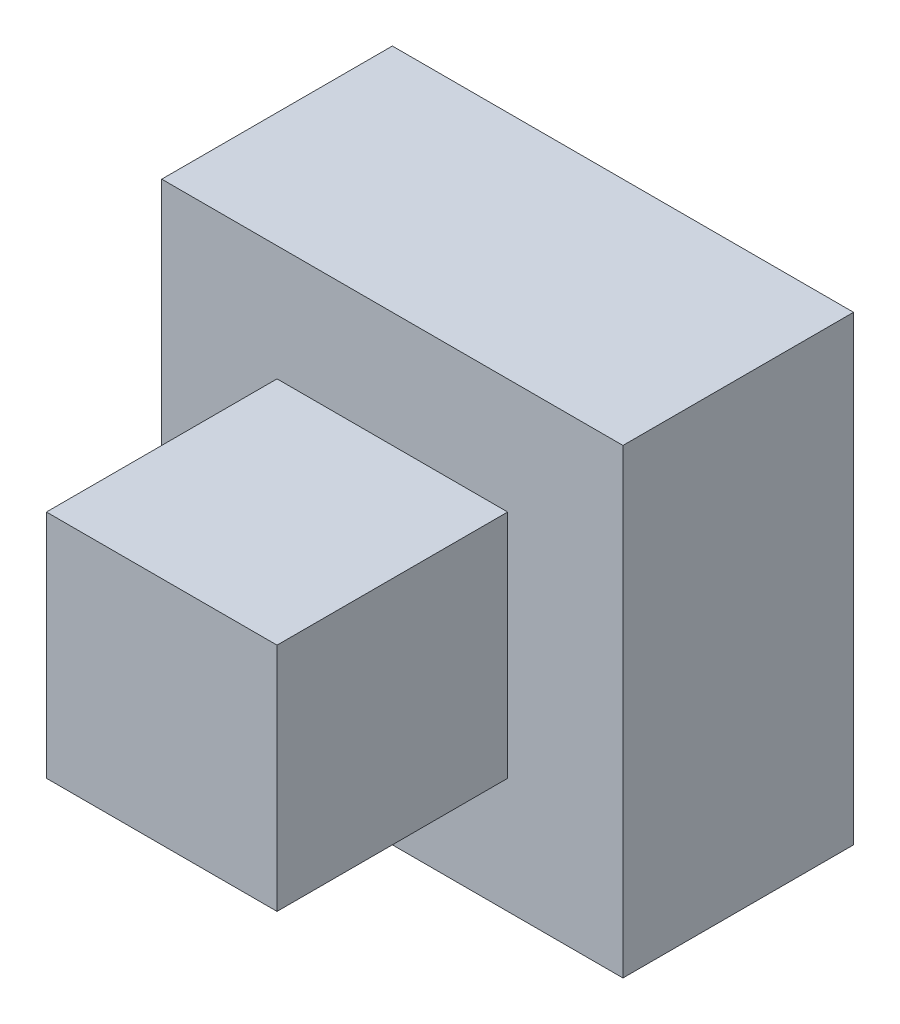
from build123d import *

# Parameters (mm, degrees)
SKETCH_1_W                = 20
SKETCH_1_H                = 20
BASEBOX_DEPTH             = 10
SKETCH_2_W                = 10
SKETCH_2_H                = 10
DRAFTDIR2_DEPTH           = 10
DRAFTDIR2_OTHER_WAY_DEPTH = 5
DRAFTDIR2_OTHER_WAY_TAPER = 3


with BuildPart() as part:
    # 草图1 → BaseBox (new body)
    with BuildSketch(Plane.XY):
        with Locations((10, 10)):
            Rectangle(SKETCH_1_W, SKETCH_1_H)
    extrude(amount=BASEBOX_DEPTH)

    # 草图2 → DraftDir2 (add)
    with BuildSketch(Plane.XY.offset(10)):
        with Locations((10, 10)):
            Rectangle(SKETCH_2_W, SKETCH_2_H)
    extrude(amount=DRAFTDIR2_DEPTH)

    # 草图2 → DraftDir2 other way (add)
    with BuildSketch(Plane.XY.offset(10)):
        with Locations((10, 10)):
            Rectangle(SKETCH_2_W, SKETCH_2_H)
    extrude(amount=-DRAFTDIR2_OTHER_WAY_DEPTH, taper=DRAFTDIR2_OTHER_WAY_TAPER)


solid = part.part
